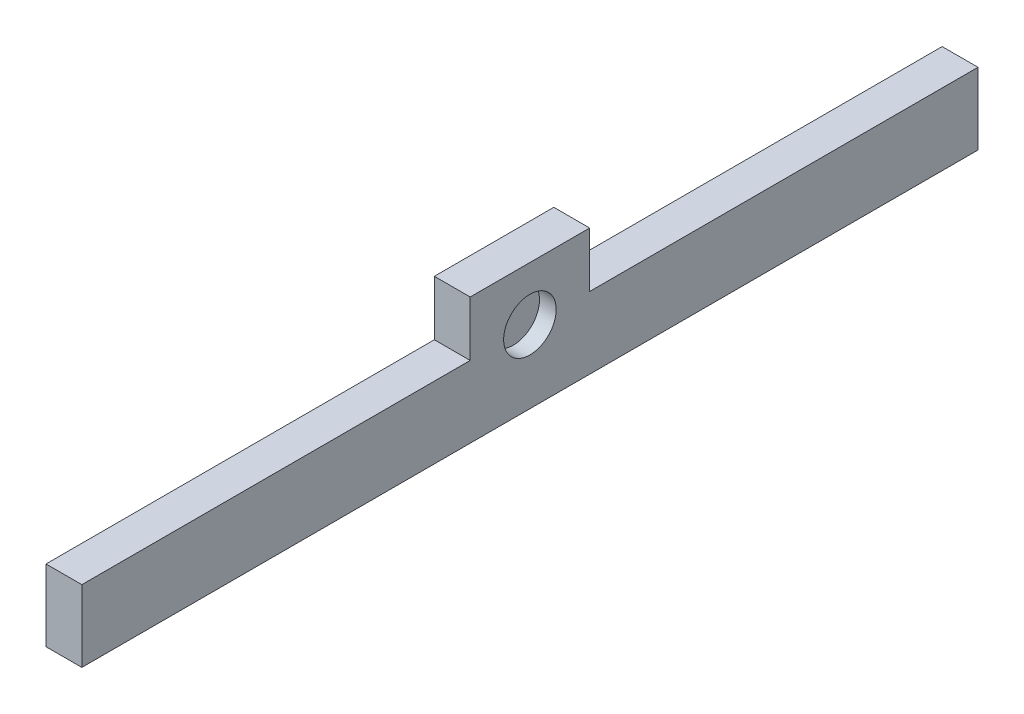
from build123d import *

# Parameters (mm, degrees)
SALIENTE_EXTRUIR1_DEPTH = 15
CROQUIS2_R              = 11
CORTAR_EXTRUIR1_DEPTH   = 7


with BuildPart() as part:
    # Croquis1 → Saliente-Extruir1 (new body)
    with BuildSketch(Plane(origin=(0, 0, 0), x_dir=(0, 0, -1), z_dir=(1, 0, 0))):
        Polygon((-187.5, 0), (187.5, 0), (187.5, 30), (25, 30), (25, 53), (-25, 53), (-25, 30), (-187.5, 30), align=None)
    extrude(amount=SALIENTE_EXTRUIR1_DEPTH)

    # Croquis2 → Cortar-Extruir1 (cut)
    with BuildSketch(Plane(origin=(15, 0, 0), x_dir=(0, 0, -1), z_dir=(1, 0, 0))):
        with Locations((0, 30.5)):
            Circle(CROQUIS2_R)
    extrude(amount=-CORTAR_EXTRUIR1_DEPTH, mode=Mode.SUBTRACT)


solid = part.part
